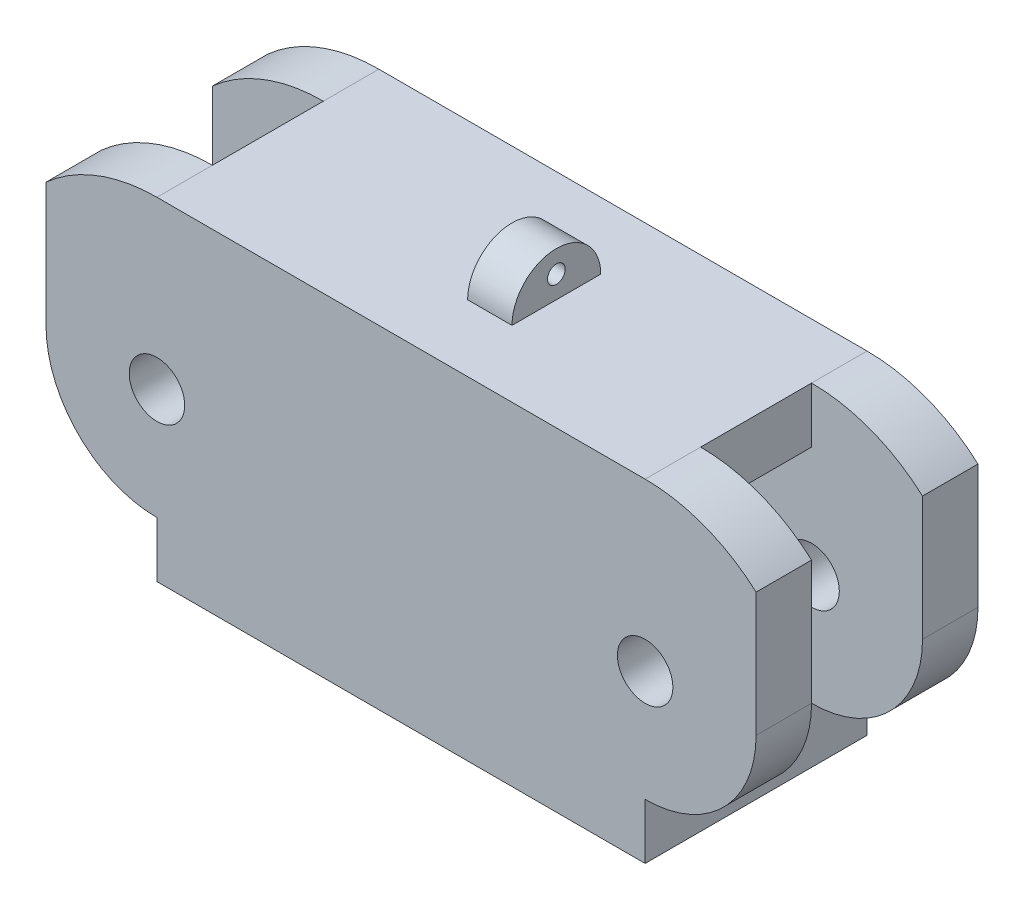
from build123d import *

# Parameters (mm, degrees)
SKETCH1_W           = 47.625
SKETCH1_H           = 19.05
BOSS_EXTRUDE1_DEPTH = 19.05
SKETCH2_R           = 1.5875
CUT_EXTRUDE1_DEPTH  = 19.05
SKETCH9_W           = 2.54
SKETCH9_H           = 5.08
BOSS_EXTRUDE2_DEPTH = 2.54
SKETCH3_R           = 0.508
SKETCH3_W           = 6.35
SKETCH3_H           = 12.7
CUT_EXTRUDE2_DEPTH  = 38.1
SKETCH4_W           = 15.197967332
SKETCH4_H           = 6.35
CUT_EXTRUDE3_DEPTH  = 43.18
CUT_EXTRUDE4_DEPTH  = 19.05
SKETCH7_W           = 13.77890267
SKETCH7_H           = 6.35
CUT_EXTRUDE5_DEPTH  = 3.81


with BuildPart() as part:
    # Sketch1 → Boss-Extrude1 (new body)
    with BuildSketch(Plane(origin=(0, 0, 0), x_dir=(1, 0, 0), z_dir=(0, 1, 0))):
        with Locations((0.3175, 0)):
            Rectangle(SKETCH1_W, SKETCH1_H)
    extrude(amount=BOSS_EXTRUDE1_DEPTH)

    # Sketch2 → Cut-Extrude1 (cut)
    with BuildSketch(Plane.XY.offset(9.525)):
        with Locations((-13.97, 9.525)):
            Circle(SKETCH2_R)
        with Locations((13.97, 9.525)):
            Circle(SKETCH2_R)
        with BuildLine():
            ThreePointArc((-13.97, 19.05), (-23.495, 9.525), (-13.97, 0))
            ThreePointArc((-13.97, 0), (-34.184765451, 9.525), (-13.97, 19.05))
        make_face()
        with BuildLine():
            ThreePointArc((13.97, 19.05), (34.184765451, 9.525), (13.97, 0))
            ThreePointArc((13.97, 0), (23.495, 9.525), (13.97, 19.05))
        make_face()
    extrude(amount=-CUT_EXTRUDE1_DEPTH, mode=Mode.SUBTRACT)

    # Sketch9 → Boss-Extrude2 (add)
    with BuildSketch(Plane(origin=(0, 19.05, 0), x_dir=(1, 0, 0), z_dir=(0, 1, 0))):
        with Locations((1.27, 0)):
            Rectangle(SKETCH9_W, SKETCH9_H)
    extrude(amount=BOSS_EXTRUDE2_DEPTH)

    # Sketch3 → Cut-Extrude2 (cut, symmetric)
    with BuildSketch(Plane(origin=(0, 0, 0), x_dir=(0, 0, -1), z_dir=(1, 0, 0))):
        with Locations((0, 20.32)):
            Circle(SKETCH3_R)
        with Locations((0, 9.525)):
            Rectangle(SKETCH3_W, SKETCH3_H)
        with BuildLine():
            ThreePointArc((-2.54, 19.05), (0, 21.59), (2.54, 19.05))
            ThreePointArc((2.54, 19.05), (0, 24.1080653), (-2.54, 19.05))
        make_face()
    extrude(amount=CUT_EXTRUDE2_DEPTH, both=True, mode=Mode.SUBTRACT)

    # Sketch4 → Cut-Extrude3 (cut)
    with BuildSketch(Plane(origin=(0, 19.05, 0), x_dir=(1, 0, 0), z_dir=(0, 1, 0))):
        Polygon((-29.361154188, -9.525), (-13.97, -9.525), (1.5875, -9.525), (28.406626571, -9.525), (28.406626571, -6.35), (1.5875, -6.35), (-13.97, -6.35), (-29.361154188, -6.35), align=None)
        Polygon((-13.97, 6.35), (-31.510324581, 6.35), (-31.510324581, 9.525), (-11.1125, 9.525), (1.5875, 9.525), (30.675017081, 9.525), (30.675017081, 6.35), (1.5875, 6.35), align=None)
        with Locations((21.568983666, 0)):
            Rectangle(SKETCH4_W, SKETCH4_H)
    extrude(amount=-CUT_EXTRUDE3_DEPTH, mode=Mode.SUBTRACT)

    # Sketch6 → Cut-Extrude4 (cut)
    with BuildSketch(Plane.XY.offset(9.525)):
        with BuildLine():
            Line((13.97, 0), (31.980086248, 0))
            Line((31.980086248, 0), (31.980086248, 3.175))
            Line((31.980086248, 3.175), (27.183594801, 13.808491056))
            Line((27.183594801, 13.808491056), (20.32, 24.370653281))
            Line((20.32, 24.370653281), (20.32, 9.525))
            ThreePointArc((20.32, 9.525), (18.460128061, 5.034871939), (13.97, 3.175))
            Line((13.97, 3.175), (13.97, 0))
        make_face()
        with BuildLine():
            Line((-13.97, 0), (-13.97, 3.175))
            ThreePointArc((-13.97, 3.175), (-18.460128061, 5.034871939), (-20.32, 9.525))
            Line((-20.32, 9.525), (-20.32, 20.942771878))
            Line((-20.32, 20.942771878), (-28.921644245, 11.767684684))
            Line((-28.921644245, 11.767684684), (-28.921644245, 0))
            Line((-28.921644245, 0), (-13.97, 0))
        make_face()
    extrude(amount=-CUT_EXTRUDE4_DEPTH, mode=Mode.SUBTRACT)

    # Sketch7 → Cut-Extrude5 (cut)
    with BuildSketch(Plane(origin=(0, 19.05, 0), x_dir=(1, 0, 0), z_dir=(0, 1, 0))):
        with Locations((-20.859451335, 0)):
            Rectangle(SKETCH7_W, SKETCH7_H)
    extrude(amount=-CUT_EXTRUDE5_DEPTH, mode=Mode.SUBTRACT)


solid = part.part
